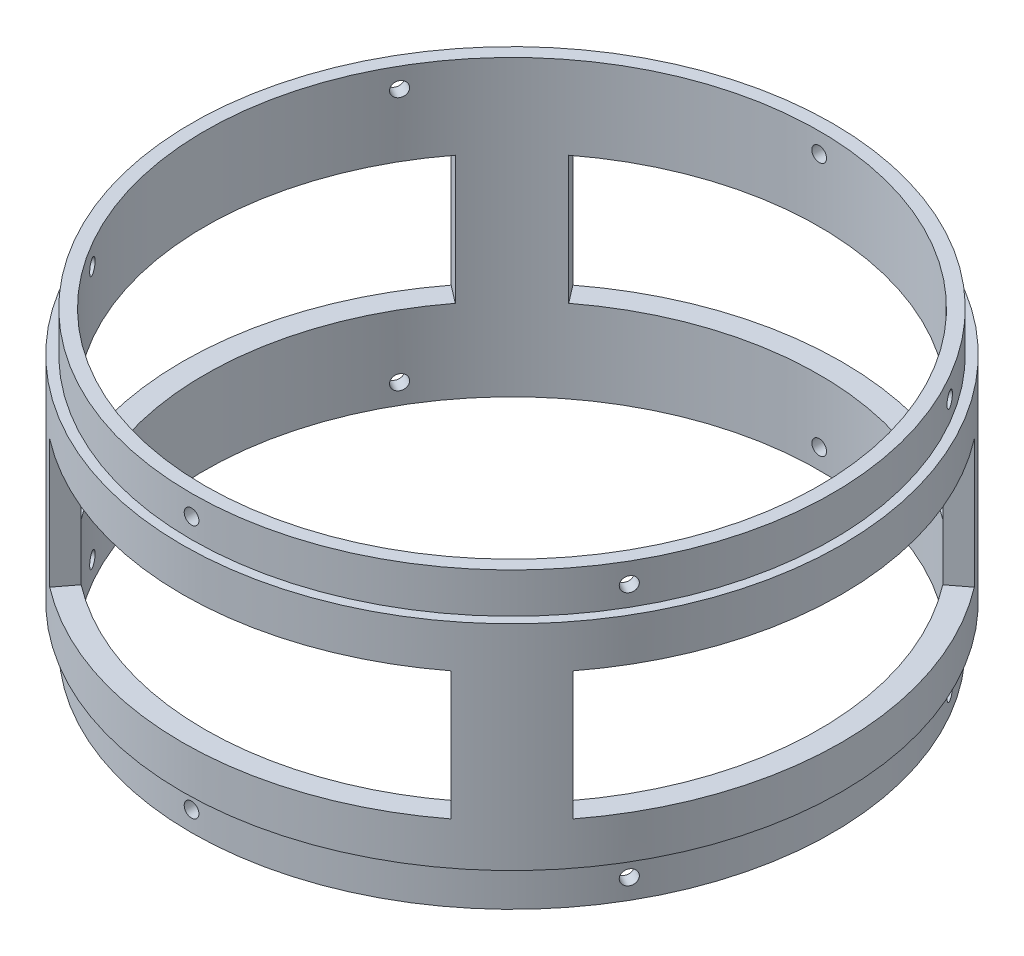
from build123d import *
from build123d.topology import SkipClean

# Parameters (mm, degrees)
SKETCH1_R               = 78.359
SKETCH1_R_2             = 73.025
BOSS_EXTRUDE1_DEPTH     = 50.8
BOSS_EXTRUDE2_START     = 50.8
BOSS_EXTRUDE2_DEPTH     = 9.525
BOSS_EXTRUDE3_START     = -9.525
SKETCH1_4_R             = 76.1746
SKETCH1_4_R_2           = 73.025
BOSS_EXTRUDE3_DEPTH     = 9.525
CUT_EXTRUDE2_REACH      = 185.466
CUT_EXTRUDE2_END_RADIUS = 73.025
CUT_EXTRUDE3_START      = 10.16
CUT_EXTRUDE3_DEPTH      = 30.48
CIRPATTERN2_COUNT       = 4
CIRPATTERN3_COUNT       = 6


with BuildPart() as part:
    # Sketch1 → Boss-Extrude1 (new body)
    with BuildSketch(Plane(origin=(0, 0, 0), x_dir=(1, 0, 0), z_dir=(0, 1, 0))):
        with Locations(Location((0, 0, 0), (0, 0, 270))):
            Circle(SKETCH1_R)
        with Locations(Location((0, 0, 0), (0, 0, 270))):
            Circle(SKETCH1_R_2, mode=Mode.SUBTRACT)
    extrude(amount=BOSS_EXTRUDE1_DEPTH)

    # Sketch1<3> → Boss-Extrude2 (add)
    with BuildSketch(Plane(origin=(0, 0, 0), x_dir=(1, 0, 0), z_dir=(0, 1, 0)).offset(BOSS_EXTRUDE2_START)):
        with BuildLine():
            ThreePointArc((73.025, 0), (-32.298131603, -65.49413195), (-44.454803353, 57.934627675))
            Line((-44.454803353, 57.934627675), (-46.37215835, 60.433373355))
            ThreePointArc((-46.37215835, 60.433373355), (-33.691164062, -68.318922337), (76.1746, 0))
            ThreePointArc((76.1746, 0), (68.318922337, 33.691164062), (46.37215835, 60.433373355))
            Line((46.37215835, 60.433373355), (44.454803353, 57.934627675))
            ThreePointArc((44.454803353, 57.934627675), (65.49413195, 32.298131603), (73.025, 0))
        make_face()
        with BuildLine():
            Line((-46.37215835, 60.433373355), (-44.454803353, 57.934627675))
            ThreePointArc((-44.454803353, 57.934627675), (0, 73.025), (44.454803353, 57.934627675))
            Line((44.454803353, 57.934627675), (46.37215835, 60.433373355))
            ThreePointArc((46.37215835, 60.433373355), (0, 76.1746), (-46.37215835, 60.433373355))
        make_face()
    extrude(amount=BOSS_EXTRUDE2_DEPTH)

    # Sketch1<4> → Boss-Extrude3 (add)
    with BuildSketch(Plane(origin=(0, 0, 0), x_dir=(1, 0, 0), z_dir=(0, 1, 0)).offset(BOSS_EXTRUDE3_START)):
        with Locations(Location((0, 0, 0), (0, 0, 90))):
            Circle(SKETCH1_4_R)
        with Locations(Location((0, 0, 0), (0, 0, 270))):
            Circle(SKETCH1_4_R_2, mode=Mode.SUBTRACT)
    extrude(amount=BOSS_EXTRUDE3_DEPTH)

    # Cut-Extrude2: up to this cylinder (the profile starts outside it)
    with SkipClean():  # the faces are left unmerged after this step: merging them gives an invalid solid
        cut_extrude2_end = Plane(origin=(0, 25.4, 0), z_dir=(0, -1, 0)) * Cylinder(CUT_EXTRUDE2_END_RADIUS, 578.307, mode=Mode.PRIVATE)
        # Sketch3 → Cut-Extrude2 (cut, up to the surface)
        with BuildSketch(Plane(origin=(0, 0, -76.1746), x_dir=(-1, 0, 0), z_dir=(0, 0, -1)), mode=Mode.PRIVATE) as cut_extrude2_sk1:
            with BuildLine():
                ThreePointArc((1.75, 55.5625), (1.237436867, 56.799936867), (0, 57.3125))
                Line((0, 57.3125), (0, 53.8125))
                ThreePointArc((0, 53.8125), (1.237436867, 54.325063133), (1.75, 55.5625))
            make_face()
        cut_extrude2_tool1 = extrude(cut_extrude2_sk1.sketch, amount=-CUT_EXTRUDE2_REACH, mode=Mode.PRIVATE) - cut_extrude2_end
        # Sketch3 → Cut-Extrude2 (cut, up to the surface)
        with BuildSketch(Plane(origin=(0, 0, -76.1746), x_dir=(-1, 0, 0), z_dir=(0, 0, -1)), mode=Mode.PRIVATE) as cut_extrude2_sk2:
            with BuildLine():
                Line((0, 53.8125), (0, 57.3125))
                ThreePointArc((0, 57.3125), (-1.75, 55.5625), (0, 53.8125))
            make_face()
        cut_extrude2_tool2 = extrude(cut_extrude2_sk2.sketch, amount=-CUT_EXTRUDE2_REACH, mode=Mode.PRIVATE) - cut_extrude2_end
        # Sketch3 → Cut-Extrude2 (cut, up to the surface)
        with BuildSketch(Plane(origin=(0, 0, -76.1746), x_dir=(-1, 0, 0), z_dir=(0, 0, -1)), mode=Mode.PRIVATE) as cut_extrude2_sk3:
            with BuildLine():
                ThreePointArc((1.75, 55.5625), (1.237436867, 56.799936867), (0, 57.3125))
                Line((0, 57.3125), (0, 53.8125))
                ThreePointArc((0, 53.8125), (1.237436867, 54.325063133), (1.75, 55.5625))
            make_face()
        cut_extrude2_tool3 = extrude(cut_extrude2_sk3.sketch, amount=-CUT_EXTRUDE2_REACH, mode=Mode.PRIVATE) - cut_extrude2_end
        # Sketch3 → Cut-Extrude2 (cut, up to the surface)
        with BuildSketch(Plane(origin=(0, 0, -76.1746), x_dir=(-1, 0, 0), z_dir=(0, 0, -1)), mode=Mode.PRIVATE) as cut_extrude2_sk4:
            with BuildLine():
                Line((0, 53.8125), (0, 57.3125))
                ThreePointArc((0, 57.3125), (-1.75, 55.5625), (0, 53.8125))
            make_face()
        cut_extrude2_tool4 = extrude(cut_extrude2_sk4.sketch, amount=-CUT_EXTRUDE2_REACH, mode=Mode.PRIVATE) - cut_extrude2_end
        # Sketch3 → Cut-Extrude2 (cut, up to the surface)
        with BuildSketch(Plane(origin=(0, 0, -76.1746), x_dir=(-1, 0, 0), z_dir=(0, 0, -1)), mode=Mode.PRIVATE) as cut_extrude2_sk5:
            with BuildLine():
                ThreePointArc((1.75, -4.7625), (1.237436867, -3.525063133), (0, -3.0125))
                Line((0, -3.0125), (0, -6.5125))
                ThreePointArc((0, -6.5125), (1.237436867, -5.999936867), (1.75, -4.7625))
            make_face()
        cut_extrude2_tool5 = extrude(cut_extrude2_sk5.sketch, amount=-CUT_EXTRUDE2_REACH, mode=Mode.PRIVATE) - cut_extrude2_end
        # Sketch3 → Cut-Extrude2 (cut, up to the surface)
        with BuildSketch(Plane(origin=(0, 0, -76.1746), x_dir=(-1, 0, 0), z_dir=(0, 0, -1)), mode=Mode.PRIVATE) as cut_extrude2_sk6:
            with BuildLine():
                Line((0, -6.5125), (0, -3.0125))
                ThreePointArc((0, -3.0125), (-1.75, -4.7625), (0, -6.5125))
            make_face()
        cut_extrude2_tool6 = extrude(cut_extrude2_sk6.sketch, amount=-CUT_EXTRUDE2_REACH, mode=Mode.PRIVATE) - cut_extrude2_end
        # Sketch3 → Cut-Extrude2 (cut, up to the surface)
        with BuildSketch(Plane(origin=(0, 0, -76.1746), x_dir=(-1, 0, 0), z_dir=(0, 0, -1)), mode=Mode.PRIVATE) as cut_extrude2_sk7:
            with BuildLine():
                ThreePointArc((1.75, -4.7625), (1.237436867, -3.525063133), (0, -3.0125))
                Line((0, -3.0125), (0, -6.5125))
                ThreePointArc((0, -6.5125), (1.237436867, -5.999936867), (1.75, -4.7625))
            make_face()
        cut_extrude2_tool7 = extrude(cut_extrude2_sk7.sketch, amount=-CUT_EXTRUDE2_REACH, mode=Mode.PRIVATE) - cut_extrude2_end
        # Sketch3 → Cut-Extrude2 (cut, up to the surface)
        with BuildSketch(Plane(origin=(0, 0, -76.1746), x_dir=(-1, 0, 0), z_dir=(0, 0, -1)), mode=Mode.PRIVATE) as cut_extrude2_sk8:
            with BuildLine():
                Line((0, -6.5125), (0, -3.0125))
                ThreePointArc((0, -3.0125), (-1.75, -4.7625), (0, -6.5125))
            make_face()
        cut_extrude2_tool8 = extrude(cut_extrude2_sk8.sketch, amount=-CUT_EXTRUDE2_REACH, mode=Mode.PRIVATE) - cut_extrude2_end
        cut_extrude2 = cut_extrude2_tool1.solids().sort_by_distance((-0.742723, 55.5625, -76.1746))[0] + cut_extrude2_tool2.solids().sort_by_distance((0.742723, 55.5625, -76.1746))[0] + cut_extrude2_tool3.solids().sort_by_distance((-0.742723, 55.5625, -76.1746))[0] + cut_extrude2_tool4.solids().sort_by_distance((0.742723, 55.5625, -76.1746))[0] + cut_extrude2_tool5.solids().sort_by_distance((-0.742723, -4.7625, -76.1746))[0] + cut_extrude2_tool6.solids().sort_by_distance((0.742723, -4.7625, -76.1746))[0] + cut_extrude2_tool7.solids().sort_by_distance((-0.742723, -4.7625, -76.1746))[0] + cut_extrude2_tool8.solids().sort_by_distance((0.742723, -4.7625, -76.1746))[0]
        add(cut_extrude2, mode=Mode.SUBTRACT)

    # Sketch1<7> → Cut-Extrude3 (cut)
    with SkipClean():  # the faces are left unmerged after this step: merging them gives an invalid solid
        with BuildSketch(Plane(origin=(0, 0, 0), x_dir=(1, 0, 0), z_dir=(0, 1, 0)).offset(CUT_EXTRUDE3_START)):
            with BuildLine():
                ThreePointArc((-44.454803353, 57.934627675), (0, 73.025), (44.454803353, 57.934627675))
                Line((44.454803353, 57.934627675), (47.701936816, 62.166374392))
                ThreePointArc((47.701936816, 62.166374392), (0, 78.359), (-47.701936816, 62.166374392))
                Line((-47.701936816, 62.166374392), (-44.454803353, 57.934627675))
            make_face()
        cut_extrude3 = extrude(amount=CUT_EXTRUDE3_DEPTH, mode=Mode.SUBTRACT)

    # CirPattern2: Cut-Extrude3 ×4 about axis
    with SkipClean():  # the faces are left unmerged after this step: merging them gives an invalid solid
        cirpattern2_axis = Axis((0, 0, 0), (0, 1, 0))
        for i in range(1, CIRPATTERN2_COUNT):
            add(cut_extrude3.rotate(cirpattern2_axis, i * 360 / CIRPATTERN2_COUNT), mode=Mode.SUBTRACT)

    # CirPattern3: Cut-Extrude2 ×6 about axis
    with SkipClean():  # the faces are left unmerged after this step: merging them gives an invalid solid
        cirpattern3_axis = Axis((0, 0, 0), (0, 1, 0))
        for i in range(1, CIRPATTERN3_COUNT):
            add(cut_extrude2.rotate(cirpattern3_axis, i * 360 / CIRPATTERN3_COUNT), mode=Mode.SUBTRACT)


solid = part.part
